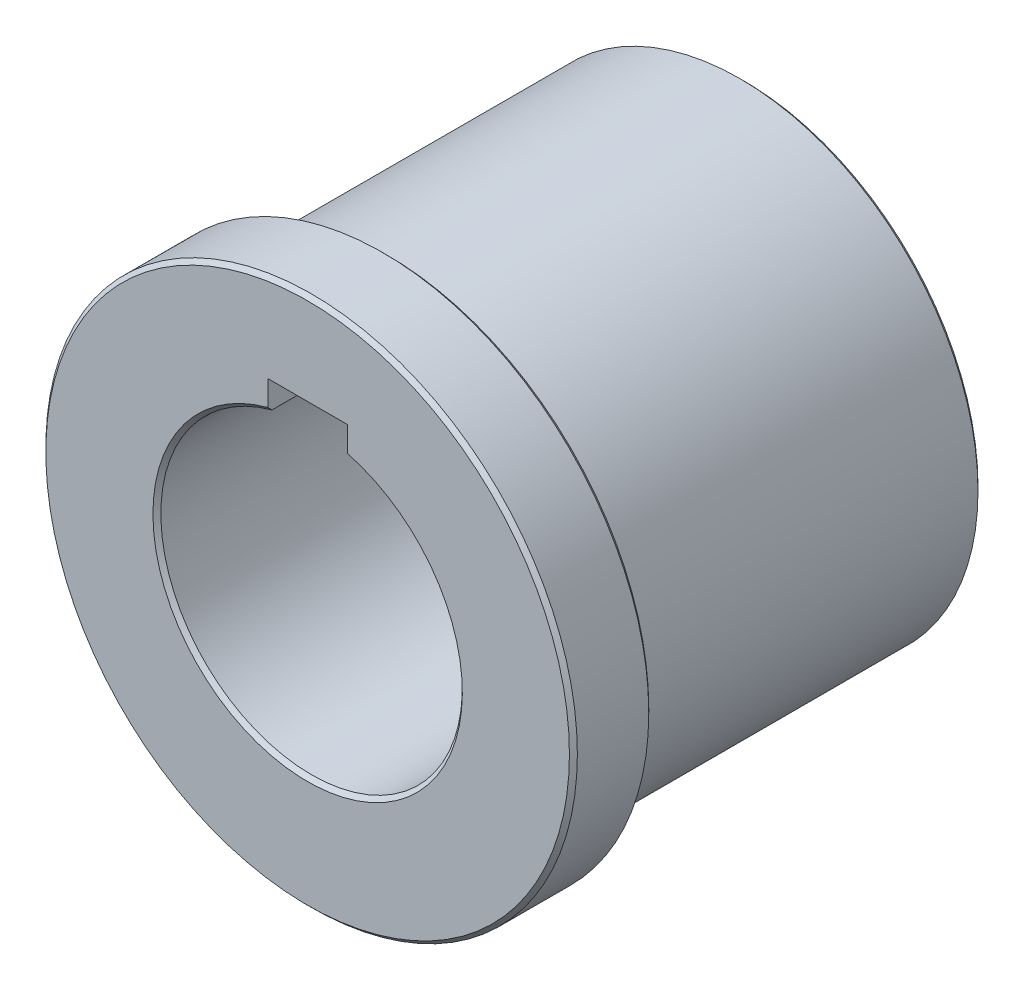
from build123d import *

# Parameters (mm, degrees)
SKETCH_1_R          = 30
EXTRUDE_1_DEPTH     = 45
SKETCH_3_R          = 33.5
EXTRUDE_2_DEPTH     = 10
CUT_EXTRUDE_1_DEPTH = 73.591321795
SKETCH_5_R          = 3
CUT_EXTRUDE_2_DEPTH = 18
CHAMFER_1_SIZE      = 0.5


with BuildPart() as part:
    # 草图1 → 凸台-拉伸1 (new body)
    with BuildSketch(Plane.XY):
        with Locations(Location((0, 0, 0), (0, 0, 180))):
            Circle(SKETCH_1_R)
    extrude(amount=EXTRUDE_1_DEPTH)

    # 草图3 → 凸台-拉伸2 (add)
    with BuildSketch(Plane.XY.offset(45)):
        Circle(SKETCH_3_R)
    extrude(amount=EXTRUDE_2_DEPTH)

    # 草图4 → 切除-拉伸1 (cut, through all)
    with BuildSketch(Plane.XY.offset(55)):
        with BuildLine():
            Line((-5, 18.33030278), (-5, 22))
            Line((-5, 22), (5, 22))
            Line((5, 22), (5, 18.33030278))
            ThreePointArc((5, 18.33030278), (0, -19), (-5, 18.33030278))
        make_face()
    extrude(amount=-CUT_EXTRUDE_1_DEPTH, mode=Mode.SUBTRACT)

    # 草图5 → 切除-拉伸2 (cut)
    with BuildSketch(Plane.XY):
        with Locations((-12.5, 21.650635095)):
            Circle(SKETCH_5_R)
        with Locations((12.5, 21.650635095)):
            Circle(SKETCH_5_R)
        with Locations((25, 0)):
            Circle(SKETCH_5_R)
        with Locations((12.5, -21.650635095)):
            Circle(SKETCH_5_R)
        with Locations((-12.5, -21.650635095)):
            Circle(SKETCH_5_R)
        with Locations((-25, 0)):
            Circle(SKETCH_5_R)
    extrude(amount=CUT_EXTRUDE_2_DEPTH, mode=Mode.SUBTRACT)

    # 倒角1
    chamfer_1_edges = [part.edges().sort_by_distance(p)[0] for p in [
        (0, -19, 0),
        (0, -19, 55),
        (30, 0, 0),
        (-33.5, 0, 45),
        (-33.5, 0, 55),
    ]]
    chamfer(chamfer_1_edges, length=CHAMFER_1_SIZE)


solid = part.part
